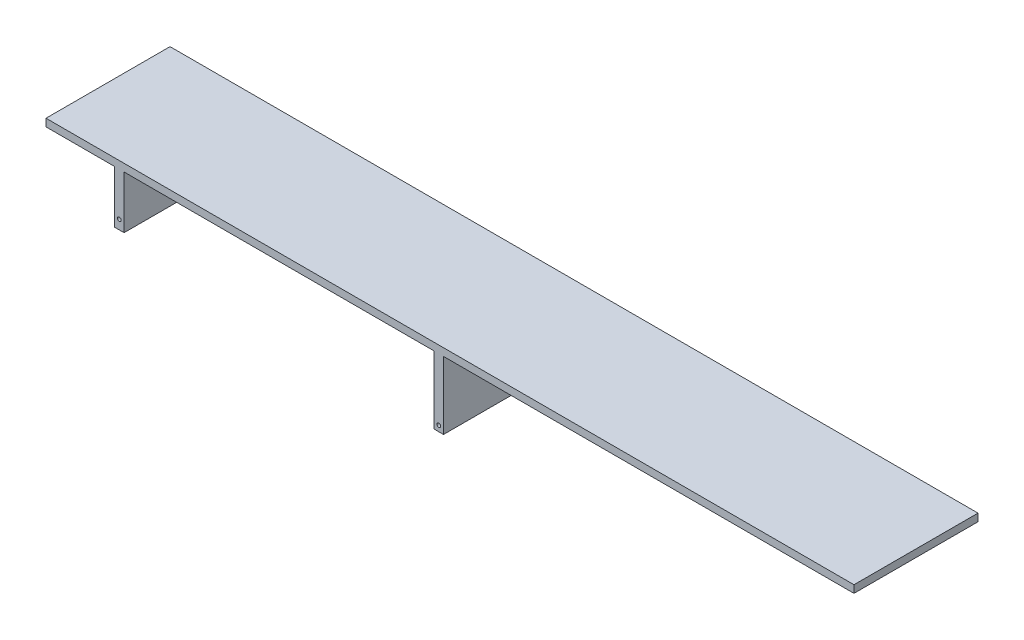
from build123d import *

# Parameters (mm, degrees)
ESQUISSE1_R        = 1
BOSS_EXTRU_1_DEPTH = 66


with BuildPart() as part:
    # Esquisse1 → Boss.-Extru.1 (new body)
    with BuildSketch(Plane.XY):
        Polygon((-60.616290102, 24.580164319), (-24.070119878, 24.580164319), (-24.070119878, -3.419835681), (-19.070119878, -3.419835681), (-19.070119878, 24.580164319), (145.929880122, 24.580164319), (145.929880122, -11.419835681), (150.929880122, -11.419835681), (150.929880122, 24.580164319), (369.383709898, 24.580164319), (369.383709898, 28.580164319), (-60.616290102, 28.580164319), align=None)
        with Locations((148.429880122, -8.419835681)):
            Circle(ESQUISSE1_R, mode=Mode.SUBTRACT)
        with Locations((-21.570119878, 1.580164319)):
            Circle(ESQUISSE1_R, mode=Mode.SUBTRACT)
    extrude(amount=BOSS_EXTRU_1_DEPTH)


solid = part.part
